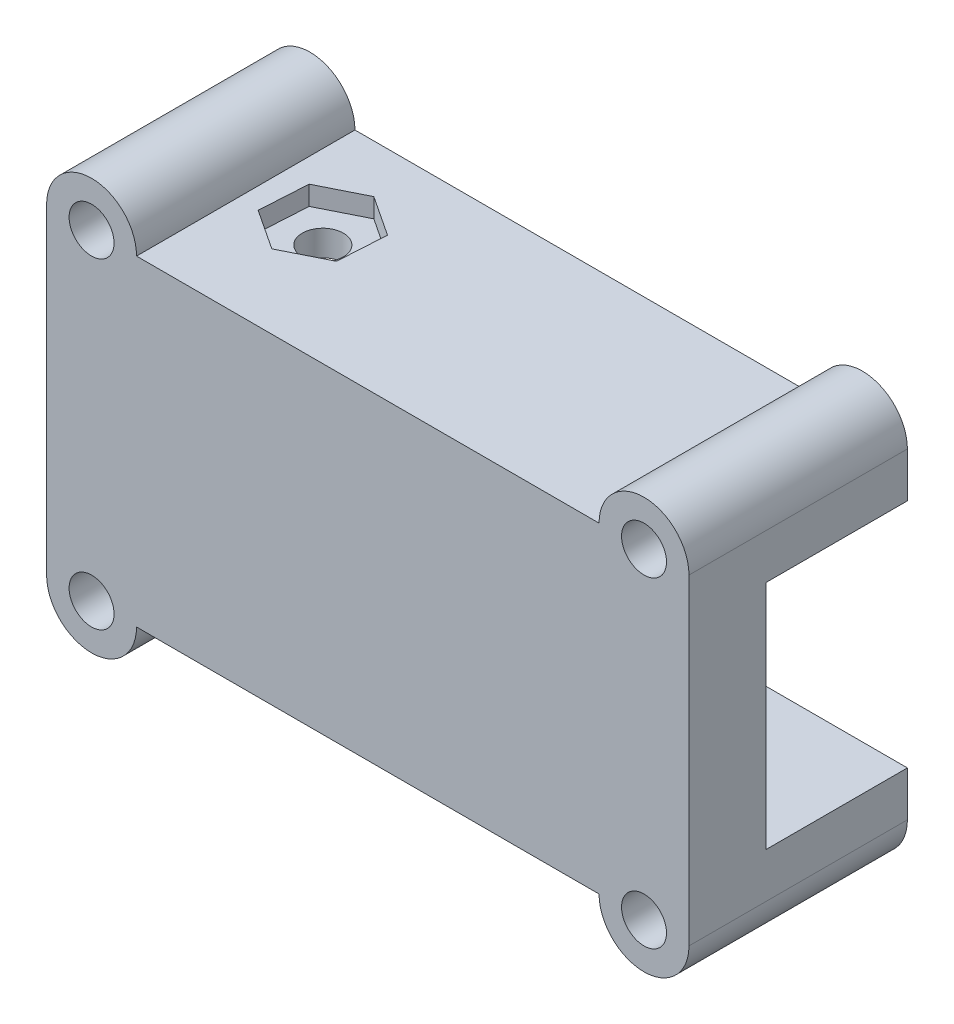
from build123d import *

# Parameters (mm, degrees)
SKETCH1_R             = 1.75
BOSS_EXTRUDE1_DEPTH   = 11
BOSS_EXTRUDE1_2_DEPTH = 11
BOSS_EXTRUDE2_START   = 11
SKETCH1_3_W           = 50
SKETCH1_3_H           = 18
SKETCH1_3_R           = 1.75
BOSS_EXTRUDE2_DEPTH   = 6
SKETCH3_R             = 4.25
CUT_EXTRUDE1_DEPTH    = 5
SKETCH4_R             = 1.6
CUT_EXTRUDE2_DEPTH    = 42.548164821
CUT_EXTRUDE3_DEPTH    = 1.5


with BuildPart() as part:
    # Sketch1 → Boss-Extrude1 (new body)
    with BuildSketch(Plane.XY):
        with BuildLine():
            Line((18, 12.5), (-18, 12.5))
            ThreePointArc((-18, 12.5), (-21.5, 16), (-25, 12.5))
            Line((-25, 12.5), (-25, 9))
            Line((-25, 9), (25, 9))
            Line((25, 9), (25, 12.5))
            ThreePointArc((25, 12.5), (21.5, 16), (18, 12.5))
        make_face()
        with Locations((-21.5, 12.5)):
            Circle(SKETCH1_R, mode=Mode.SUBTRACT)
        with Locations((21.5, 12.5)):
            Circle(SKETCH1_R, mode=Mode.SUBTRACT)
    extrude(amount=BOSS_EXTRUDE1_DEPTH)



with BuildPart() as body_2:
    # Sketch1 → Boss-Extrude1 2 (new body)
    with BuildSketch(Plane.XY):
        with BuildLine():
            Line((25, -9), (-25, -9))
            Line((-25, -9), (-25, -12.5))
            ThreePointArc((-25, -12.5), (-21.5, -16), (-18, -12.5))
            Line((-18, -12.5), (18, -12.5))
            ThreePointArc((18, -12.5), (21.5, -16), (25, -12.5))
            Line((25, -12.5), (25, -9))
        make_face()
        with Locations((-21.5, -12.5)):
            Circle(SKETCH1_R, mode=Mode.SUBTRACT)
        with Locations((21.5, -12.5)):
            Circle(SKETCH1_R, mode=Mode.SUBTRACT)
    extrude(amount=BOSS_EXTRUDE1_2_DEPTH)


with BuildPart() as part_1:
    add(part.part)

    add(body_2.part)  # Boss-Extrude2 merges body 2
    # Sketch1<3> → Boss-Extrude2 (add)
    # profile 1 of 3: a face of its own
    with BuildSketch(Plane.XY.offset(BOSS_EXTRUDE2_START)):
        Rectangle(SKETCH1_3_W, SKETCH1_3_H)
    # profile 2 of 3: a face of its own
    with BuildSketch(Plane.XY.offset(BOSS_EXTRUDE2_START)):
        with BuildLine():
            Line((18, 12.5), (-18, 12.5))
            ThreePointArc((-18, 12.5), (-21.5, 16), (-25, 12.5))
            Line((-25, 12.5), (-25, 9))
            Line((-25, 9), (25, 9))
            Line((25, 9), (25, 12.5))
            ThreePointArc((25, 12.5), (21.5, 16), (18, 12.5))
        make_face()
        with Locations((-21.5, 12.5)):
            Circle(SKETCH1_3_R, mode=Mode.SUBTRACT)
        with Locations((21.5, 12.5)):
            Circle(SKETCH1_3_R, mode=Mode.SUBTRACT)
    # profile 3 of 3: a face of its own
    with BuildSketch(Plane.XY.offset(BOSS_EXTRUDE2_START)):
        with BuildLine():
            Line((25, -9), (-25, -9))
            Line((-25, -9), (-25, -12.5))
            ThreePointArc((-25, -12.5), (-21.5, -16), (-18, -12.5))
            Line((-18, -12.5), (18, -12.5))
            ThreePointArc((18, -12.5), (21.5, -16), (25, -12.5))
            Line((25, -12.5), (25, -9))
        make_face()
        with Locations((-21.5, -12.5)):
            Circle(SKETCH1_3_R, mode=Mode.SUBTRACT)
        with Locations((21.5, -12.5)):
            Circle(SKETCH1_3_R, mode=Mode.SUBTRACT)
    extrude(amount=BOSS_EXTRUDE2_DEPTH)

    # Sketch3 → Cut-Extrude1 (cut)
    with BuildSketch(Plane(origin=(0, 0, 11), x_dir=(-1, 0, 0), z_dir=(0, 0, -1))):
        with Locations((-15, 0)):
            Circle(SKETCH3_R)
    extrude(amount=-CUT_EXTRUDE1_DEPTH, mode=Mode.SUBTRACT)

    # Sketch4 → Cut-Extrude2 (cut, through all)
    with BuildSketch(Plane.XZ.offset(12.5)):
        with Locations(Location((-13, 7.5, 0), (0, 0, 270))):
            Circle(SKETCH4_R)
    extrude(amount=-CUT_EXTRUDE2_DEPTH, mode=Mode.SUBTRACT)

    # Sketch5 → Cut-Extrude3 (cut)
    with BuildSketch(Plane(origin=(0, 12.5, 0), x_dir=(1, 0, 0), z_dir=(0, 1, 0))):
        Polygon((-9.868012442, -9.567362395), (-9.643617868, -5.821300408), (-12.775605426, -3.753938013), (-16.131987558, -5.432637605), (-16.356382132, -9.178699592), (-13.224394574, -11.246061987), align=None)
    extrude(amount=-CUT_EXTRUDE3_DEPTH, mode=Mode.SUBTRACT)


solid = part_1.part
